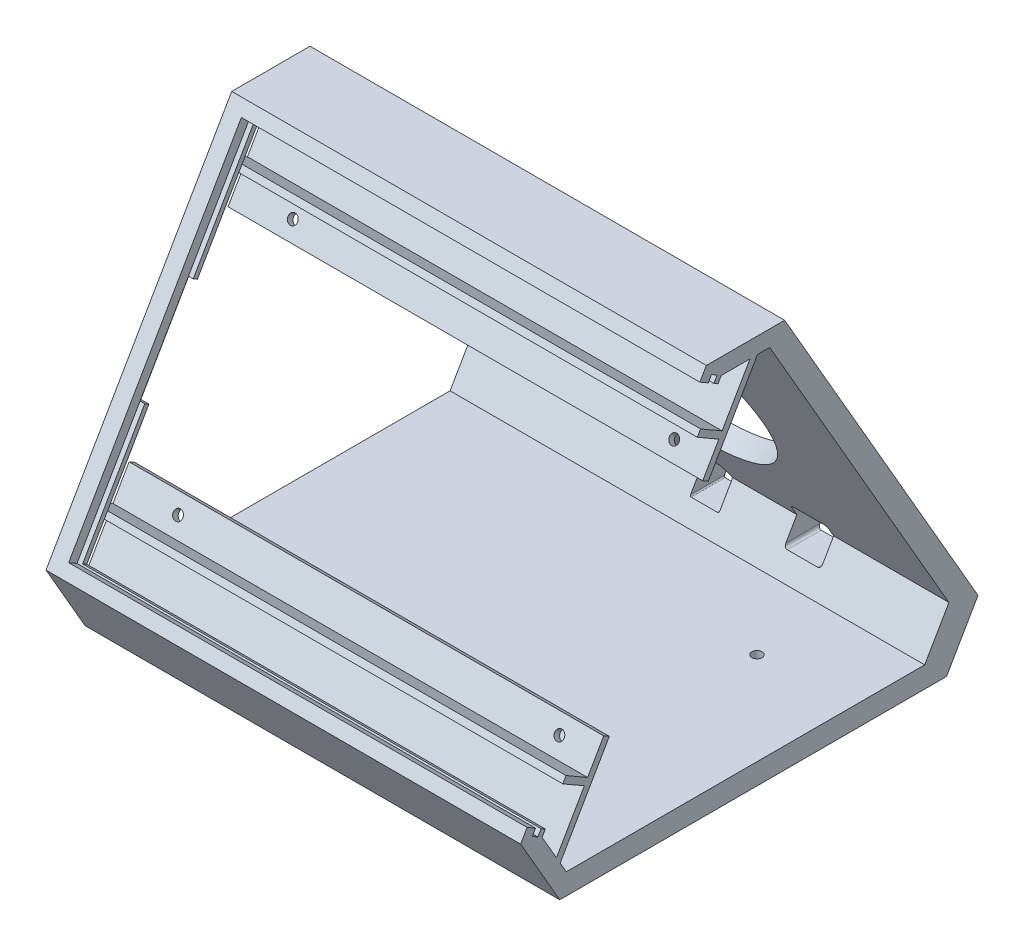
from build123d import *

# Parameters (mm, degrees)
BOSS_EXTRUDE1_DEPTH = 155
SKETCH4_W           = 144
SKETCH4_H           = 111
CUT_EXTRUDE1_DEPTH  = 5
SKETCH5_R           = 38.5
CUT_EXTRUDE2_DEPTH  = 10
BOSS_EXTRUDE2_DEPTH = 5
CUT_EXTRUDE3_DEPTH  = 5
CUT_EXTRUDE4_DEPTH  = 2.5
CUT_EXTRUDE5_DEPTH  = 2.5
BOSS_EXTRUDE3_DEPTH = 142
SKETCH12_R          = 38.5
CUT_EXTRUDE6_DEPTH  = 6.5
BOSS_EXTRUDE4_DEPTH = 147
CUT_EXTRUDE7_DEPTH  = 25
SKETCH16_R          = 1.5
CUT_EXTRUDE8_DEPTH  = 5
SKETCH17_R          = 1.5875
CUT_EXTRUDE9_DEPTH  = 10


with BuildPart() as part:
    # Sketch3 → Boss-Extrude1 (new body)
    with BuildSketch(Plane(origin=(0, 0, 0), x_dir=(0, 0, -1), z_dir=(1, 0, 0))):
        Polygon((58.381197846, 114.119200877), (0.860471904, 14.490381057), (12.979274058, -6.5), (132.75, -6.5), (142.504165125, 10.394709581), (82.618802154, 114.119200877), align=None)
        Polygon((7.5, 12.990381057), (15, 0), (15, -1.5), (126, -1.5), (126, 0), (133.5, 12.990381057), (134.799038106, 13.740381057), (79.299038106, 109.869200877), (78, 109.119200877), (63, 109.119200877), (61.700961894, 109.869200877), (6.200961894, 13.740381057), align=None, mode=Mode.SUBTRACT)
    extrude(amount=BOSS_EXTRUDE1_DEPTH)

    # Sketch4 → Cut-Extrude1 (cut)
    with BuildSketch(Plane(origin=(0, 3.25, 5.629165125), x_dir=(1, 0, 0), z_dir=(0, 0.4999999999999995, 0.8660254037844389))):
        with Locations((77.5, 70.5)):
            Rectangle(SKETCH4_W, SKETCH4_H)
    extrude(amount=-CUT_EXTRUDE1_DEPTH, mode=Mode.SUBTRACT)

    # Sketch5 → Cut-Extrude2 (cut)
    with BuildSketch(Plane(origin=(0, 64.304790967, -111.379165125), x_dir=(-1, 0, 0), z_dir=(0, 0.5000000000000006, -0.8660254037844385))):
        with Locations(Location((-77.5, -2.364637029, 0), (0, 0, 90))):
            Circle(SKETCH5_R)
    extrude(amount=-CUT_EXTRUDE2_DEPTH, mode=Mode.SUBTRACT)


with BuildPart() as body_2:
    # Sketch6 → Boss-Extrude2 (new body)
    with BuildSketch(Plane(origin=(155, 0, 0), x_dir=(0, 0, -1), z_dir=(1, 0, 0))):
        Polygon((82.618802154, 114.119200877), (58.381197846, 114.119200877), (0.860471904, 14.490381057), (12.979274058, -6.5), (132.75, -6.5), (142.504165125, 10.394709581), align=None)
    extrude(amount=BOSS_EXTRUDE2_DEPTH)

    # Sketch7 → Cut-Extrude3 (cut)
    with BuildSketch(Plane(origin=(160, 0, 0), x_dir=(0, 0, -1), z_dir=(1, 0, 0))):
        Polygon((63, 109.119200877), (7.5, 12.990381057), (15, 0), (126, 0), (133.5, 12.990381057), (78, 109.119200877), align=None)
    extrude(amount=-CUT_EXTRUDE3_DEPTH, mode=Mode.SUBTRACT)

    # Sketch8 → Cut-Extrude4 (cut)
    with BuildSketch(Plane(origin=(160, 0, 0), x_dir=(0, 0, -1), z_dir=(1, 0, 0))):
        Polygon((6.200961894, 13.740381057), (61.700961894, 109.869200877), (59.968911087, 110.869200877), (4.468911087, 14.740381057), align=None)
    extrude(amount=-CUT_EXTRUDE4_DEPTH, mode=Mode.SUBTRACT)

    # Sketch10 → Cut-Extrude5 (cut)
    with BuildSketch(Plane(origin=(160, 0, 0), x_dir=(0, 0, -1), z_dir=(1, 0, 0))):
        Polygon((42.75, 74.045172024), (27.75, 48.06440991), (26.450961894, 48.81440991), (41.450961894, 74.795172024), align=None)
    extrude(amount=-CUT_EXTRUDE5_DEPTH, mode=Mode.SUBTRACT)

    # Sketch11 → Boss-Extrude3 (add)
    with BuildSketch(Plane(origin=(160, 0, 0), x_dir=(0, 0, -1), z_dir=(1, 0, 0))):
        Polygon((63, 109.119200877), (62, 107.387150069), (60.700961894, 108.137150069), (61.700961894, 109.869200877), (59.968911087, 110.869200877), (58.968911087, 109.137150069), (56.370834875, 110.637150069), (58.381197846, 114.119200877), (82.618802154, 114.119200877), (142.504165125, 10.394709581), (132.75, -6.5), (12.979274058, -6.5), (0.860471904, 14.490381057), (2.870834875, 17.972431864), (5.468911087, 16.472431864), (4.468911087, 14.740381057), (6.200961894, 13.740381057), (7.200961894, 15.472431864), (8.5, 14.722431864), (7.5, 12.990381057), (15, 0), (126, 0), (133.5, 12.990381057), (78, 109.119200877), align=None)
    extrude(amount=BOSS_EXTRUDE3_DEPTH)

    # Sketch12 → Cut-Extrude6 (cut)
    with BuildSketch(Plane(origin=(0, 64.304790967, -111.379165125), x_dir=(-1, 0, 0), z_dir=(0, 0.5000000000000006, -0.8660254037844384))):
        with Locations(Location((-232.5, -2.364637029, 0), (0, 0, 90))):
            Circle(SKETCH12_R)
    extrude(amount=-CUT_EXTRUDE6_DEPTH, mode=Mode.SUBTRACT)

    # Sketch13 → Boss-Extrude4 (add)
    with BuildSketch(Plane.ZY.offset(-155)):
        Polygon((-26.593395609, 30.661112341), (-21.593395609, 22.000858303), (-14.925, 25.850858303), (-13.925, 24.118807495), (-20.593395609, 20.268807495), (-11.945597073, 5.290381057), (-13.100297611, 3.290381057), (-28.325446417, 29.661112341), align=None)
        Polygon((-62.243395609, 92.408723631), (-55.575, 96.258723631), (-56.575, 97.990774438), (-63.243395609, 94.140774438), (-71.891194146, 109.119200877), (-74.200595222, 109.119200877), (-58.975446417, 82.748469593), (-57.243395609, 83.748469593), align=None)
    extrude(amount=-BOSS_EXTRUDE4_DEPTH)

    # Sketch14 → Cut-Extrude7 (cut)
    with BuildSketch(Plane.XY.offset(-150)):
        with BuildLine():
            Line((234.6666, 5.5875), (226.437, 5.5875))
            ThreePointArc((226.437, 5.5875), (226.167592316, 5.699092316), (226.056, 5.9685))
            Line((226.056, 5.9685), (226.056, 12.0391))
            ThreePointArc((226.056, 12.0391), (230.5518, 16.5349), (235.0476, 12.0391))
            Line((235.0476, 12.0391), (235.0476, 5.9685))
            ThreePointArc((235.0476, 5.9685), (234.936007684, 5.699092316), (234.6666, 5.5875))
        make_face()
        with BuildLine():
            Line((265.299934, 6.0875), (255.899934, 6.0875))
            ThreePointArc((255.899934, 6.0875), (255.192827219, 6.380393219), (254.899934, 7.0875))
            Line((254.899934, 7.0875), (254.899934, 15.5875))
            ThreePointArc((254.899934, 15.5875), (255.192827219, 16.294606781), (255.899934, 16.5875))
            Line((255.899934, 16.5875), (265.299934, 16.5875))
            ThreePointArc((265.299934, 16.5875), (266.007040781, 16.294606781), (266.299934, 15.5875))
            Line((266.299934, 15.5875), (266.299934, 7.0875))
            ThreePointArc((266.299934, 7.0875), (266.007040781, 6.380393219), (265.299934, 6.0875))
        make_face()
    extrude(amount=CUT_EXTRUDE7_DEPTH, mode=Mode.SUBTRACT)

    # Sketch16 → Cut-Extrude8 (cut)
    with BuildSketch(Plane(origin=(0, -4.85, -8.400446417), x_dir=(-1, 0, 0), z_dir=(0, -0.4999999999999997, -0.8660254037844389))):
        with Locations(Location((-172.60681079, 106.05, 0), (0, 0, 90))):
            Circle(SKETCH16_R)
        with Locations(Location((-172.60681079, 34.95, 0), (0, 0, 90))):
            Circle(SKETCH16_R)
        with Locations(Location((-290.71681079, 106.05, 0), (0, 0, 90))):
            Circle(SKETCH16_R)
        with Locations(Location((-290.71681079, 34.95, 0), (0, 0, 90))):
            Circle(SKETCH16_R)
    extrude(amount=-CUT_EXTRUDE8_DEPTH, mode=Mode.SUBTRACT)

    # Sketch17 → Cut-Extrude9 (cut)
    with BuildSketch(Plane(origin=(0, 0, 0), x_dir=(1, 0, 0), z_dir=(0, 1, 0))):
        with Locations(Location((230.12, 51.9601016, 0), (0, 0, 270))):
            Circle(SKETCH17_R)
        with Locations(Location((258.06, 51.9601016, 0), (0, 0, 270))):
            Circle(SKETCH17_R)
        with Locations(Location((273.3, 102.7601016, 0), (0, 0, 270))):
            Circle(SKETCH17_R)
    extrude(amount=-CUT_EXTRUDE9_DEPTH, mode=Mode.SUBTRACT)


solid = body_2.part
